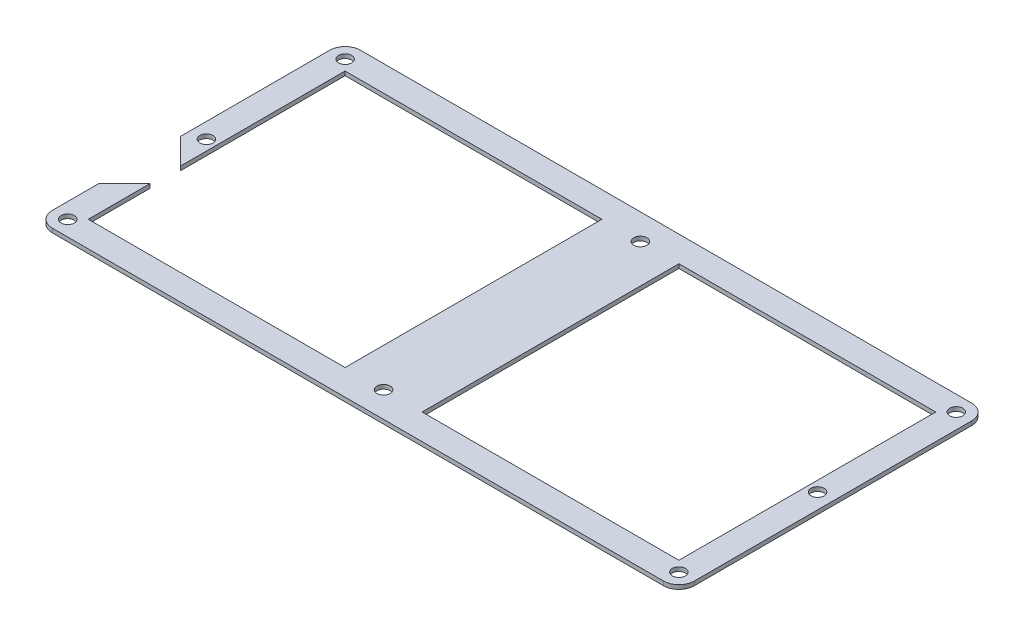
from build123d import *

# Parameters (mm, degrees)
SKETCH_1_R      = 2.55
SKETCH_1_W      = 100
SKETCH_1_H      = 100
EXTRUDE_1_DEPTH = 1.6


with BuildPart() as part:
    # 草图1 → 凸台-拉伸1 (new body)
    with BuildSketch(Plane(origin=(0, 0, 0), x_dir=(1, 0, 0), z_dir=(0, 1, 0))):
        with BuildLine():
            Line((13.495694321, 64.619803607), (13.495694321, 122.619803607))
            ThreePointArc((13.495694321, 122.619803607), (15.253053633, 126.862444294), (19.495694321, 128.619803607))
            Line((19.495694321, 128.619803607), (257.495694321, 128.619803607))
            ThreePointArc((257.495694321, 128.619803607), (261.738335008, 126.862444294), (263.495694321, 122.619803607))
            Line((263.495694321, 122.619803607), (263.495694321, 14.619803607))
            ThreePointArc((263.495694321, 14.619803607), (261.738335008, 10.37716292), (257.495694321, 8.619803607))
            Line((257.495694321, 8.619803607), (19.495694321, 8.619803607))
            ThreePointArc((19.495694321, 8.619803607), (15.253053633, 10.37716292), (13.495694321, 14.619803607))
            Line((13.495694321, 14.619803607), (13.495694321, 32.619803607))
            Line((13.495694321, 32.619803607), (23.495694321, 42.619803607))
            Line((23.495694321, 42.619803607), (23.495694321, 18.619803607))
            Line((23.495694321, 18.619803607), (123.495694321, 18.619803607))
            Line((123.495694321, 18.619803607), (123.495694321, 118.619803607))
            Line((123.495694321, 118.619803607), (23.495694321, 118.619803607))
            Line((23.495694321, 118.619803607), (23.495694321, 54.619803607))
            Line((23.495694321, 54.619803607), (13.495694321, 64.619803607))
        make_face()
        with Locations(Location((19.495694321, 122.619803607, 0), (0, 0, 270))):
            Circle(SKETCH_1_R, mode=Mode.SUBTRACT)
        with Locations(Location((257.495694321, 122.619803607, 0), (0, 0, 270))):
            Circle(SKETCH_1_R, mode=Mode.SUBTRACT)
        with Locations(Location((138.495694321, 118.619803607, 0), (0, 0, 270))):
            Circle(SKETCH_1_R, mode=Mode.SUBTRACT)
        with Locations(Location((19.495694321, 14.619803607, 0), (0, 0, 270))):
            Circle(SKETCH_1_R, mode=Mode.SUBTRACT)
        with Locations(Location((257.495694321, 14.619803607, 0), (0, 0, 270))):
            Circle(SKETCH_1_R, mode=Mode.SUBTRACT)
        with Locations(Location((138.495694321, 18.619803607, 0), (0, 0, 270))):
            Circle(SKETCH_1_R, mode=Mode.SUBTRACT)
        with Locations(Location((257.495694321, 68.619803607, 0), (0, 0, 270))):
            Circle(SKETCH_1_R, mode=Mode.SUBTRACT)
        with Locations(Location((19.495694321, 68.619803607, 0), (0, 0, 270))):
            Circle(SKETCH_1_R, mode=Mode.SUBTRACT)
        with Locations((203.495694321, 68.619803607)):
            Rectangle(SKETCH_1_W, SKETCH_1_H, mode=Mode.SUBTRACT)
    extrude(amount=EXTRUDE_1_DEPTH)


solid = part.part
